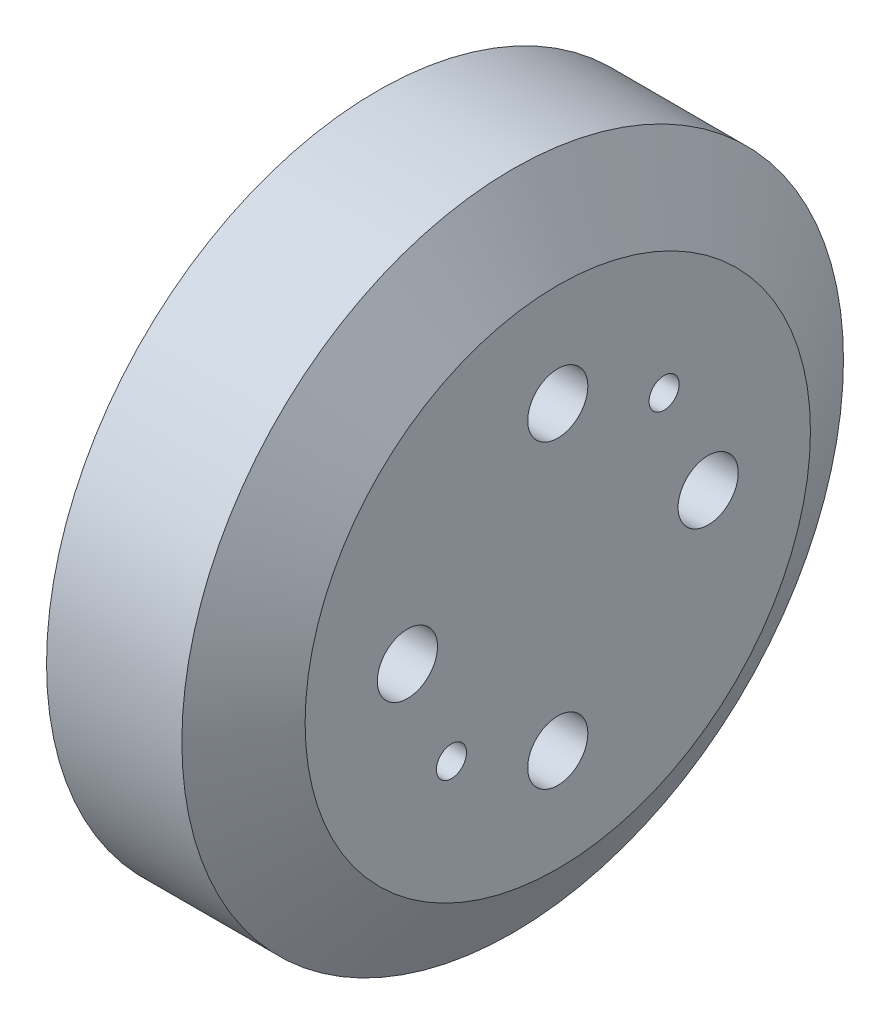
from build123d import *

# Parameters (mm, degrees)
SKETCH1_R           = 110
SKETCH1_R_2         = 100
BOSS_EXTRUDE1_DEPTH = 45
SKETCH2_R           = 110
BOSS_EXTRUDE2_DEPTH = 15
BOSS_EXTRUDE2_TAPER = 60
SKETCH3_R           = 30
BOSS_EXTRUDE3_DEPTH = 100
SKETCH4_R           = 10
SKETCH4_R_2         = 5
CUT_EXTRUDE1_DEPTH  = 100


with BuildPart() as part:
    # Sketch1 → Boss-Extrude1 (new body)
    with BuildSketch(Plane(origin=(0, 0, 0), x_dir=(0, 0, -1), z_dir=(1, 0, 0))):
        with Locations(Location((0, 0, 0), (0, 0, 180))):
            Circle(SKETCH1_R)
        with Locations(Location((0, 0, 0), (0, 0, 180))):
            Circle(SKETCH1_R_2, mode=Mode.SUBTRACT)
    extrude(amount=BOSS_EXTRUDE1_DEPTH)

    # Sketch2 → Boss-Extrude2 (add)
    with BuildSketch(Plane(origin=(45, 0, 0), x_dir=(0, 0, -1), z_dir=(1, 0, 0))):
        with Locations(Location((0, 0, 0), (0, 0, 180))):
            Circle(SKETCH2_R)
    extrude(amount=BOSS_EXTRUDE2_DEPTH, taper=BOSS_EXTRUDE2_TAPER)

    # Sketch3 → Boss-Extrude3 (add)
    with BuildSketch(Plane.ZY.offset(-45)):
        with Locations(Location((0, 0, 0), (0, 0, 180))):
            Circle(SKETCH3_R)
    extrude(amount=BOSS_EXTRUDE3_DEPTH)

    # Sketch4 → Cut-Extrude1 (cut)
    with BuildSketch(Plane(origin=(60, 0, 0), x_dir=(0, 0, -1), z_dir=(1, 0, 0))):
        with Locations((0, 50)):
            Circle(SKETCH4_R)
        with Locations((50, 0)):
            Circle(SKETCH4_R)
        with Locations((0, -50)):
            Circle(SKETCH4_R)
        with Locations((-50, 0)):
            Circle(SKETCH4_R)
        with Locations((35.355339059, 35.355339059)):
            Circle(SKETCH4_R_2)
        with Locations((-35.355339059, -35.355339059)):
            Circle(SKETCH4_R_2)
    extrude(amount=-CUT_EXTRUDE1_DEPTH, mode=Mode.SUBTRACT)


solid = part.part
